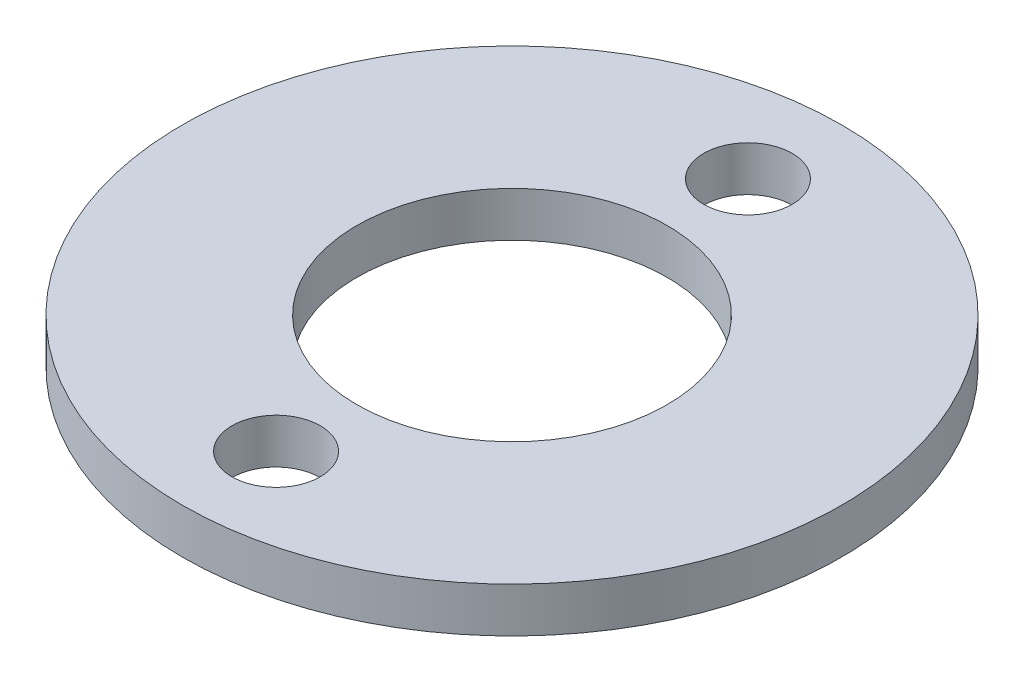
from build123d import *

# Parameters (mm, degrees)
SKETCH1_R           = 22
BOSS_EXTRUDE1_DEPTH = 3
SKETCH2_R           = 10.36
SKETCH2_R_2         = 2.952
CUT_EXTRUDE1_DEPTH  = 3


with BuildPart() as part:
    # Sketch1 → Boss-Extrude1 (new body)
    with BuildSketch(Plane(origin=(0, 0, 0), x_dir=(1, 0, 0), z_dir=(0, 1, 0))):
        with Locations(Location((0, 0, 0), (0, 0, 270))):
            Circle(SKETCH1_R)
    extrude(amount=BOSS_EXTRUDE1_DEPTH)

    # Sketch2 → Cut-Extrude1 (cut)
    with BuildSketch(Plane(origin=(0, 3, 0), x_dir=(1, 0, 0), z_dir=(0, 1, 0))):
        with Locations(Location((0, 0, 0), (0, 0, 270))):
            Circle(SKETCH2_R)
        with Locations(Location((0, 15.75, 0), (0, 0, 270))):
            Circle(SKETCH2_R_2)
        with Locations(Location((0, -15.75, 0), (0, 0, 90))):
            Circle(SKETCH2_R_2)
    extrude(amount=-CUT_EXTRUDE1_DEPTH, mode=Mode.SUBTRACT)


solid = part.part
